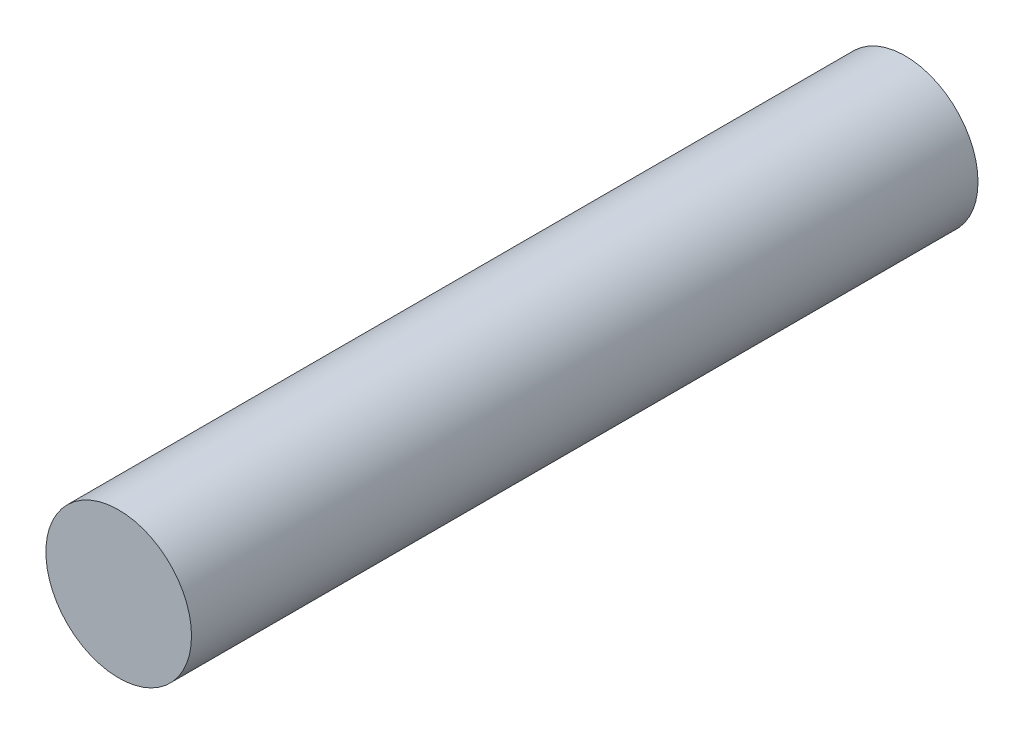
from build123d import *

# Parameters (mm, degrees)
ESQUISSE1_R        = 2.5
BOSS_EXTRU_1_DEPTH = 27


with BuildPart() as part:
    # Esquisse1 → Boss.-Extru.1 (new body)
    with BuildSketch(Plane.XY):
        Circle(ESQUISSE1_R)
    extrude(amount=BOSS_EXTRU_1_DEPTH)


solid = part.part
